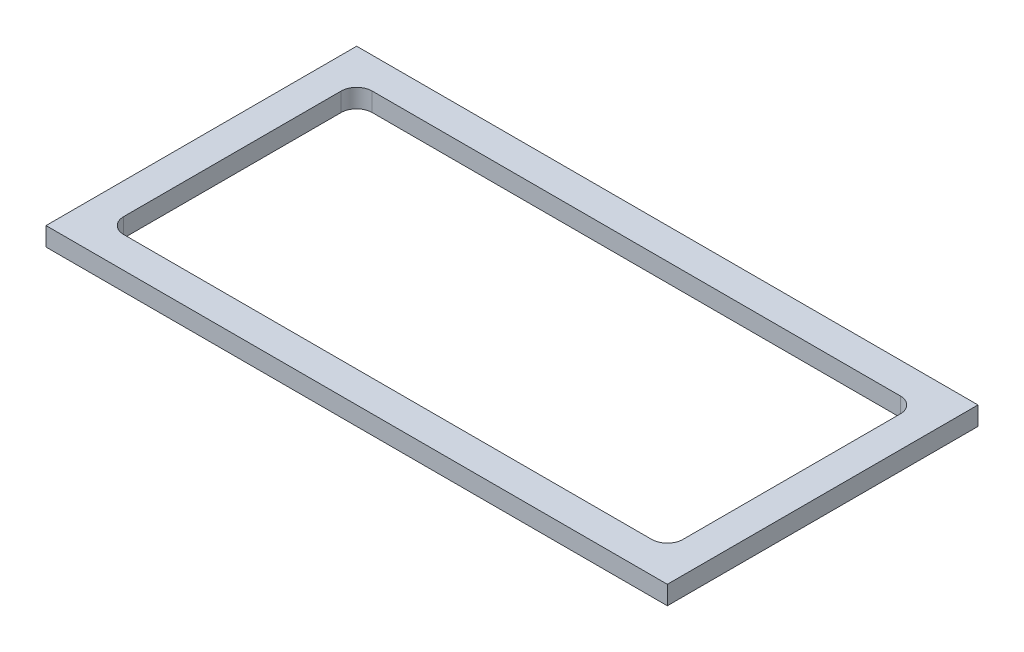
from build123d import *

# Parameters (mm, degrees)
SKETCH1_W           = 200
SKETCH1_H           = 100
BOSS_EXTRUDE1_DEPTH = 6
SKETCH2_W           = 180
SKETCH2_H           = 80
CUT_EXTRUDE1_DEPTH  = 224.687281713
FILLET1_R           = 5


with BuildPart() as part:
    # Sketch1 → Boss-Extrude1 (new body)
    with BuildSketch(Plane(origin=(0, 0, 0), x_dir=(1, 0, 0), z_dir=(0, 1, 0))):
        with Locations((100, 50)):
            Rectangle(SKETCH1_W, SKETCH1_H)
    extrude(amount=BOSS_EXTRUDE1_DEPTH)

    # Sketch2 → Cut-Extrude1 (cut, through all)
    with BuildSketch(Plane(origin=(0, 6, 0), x_dir=(1, 0, 0), z_dir=(0, 1, 0))):
        with Locations((100, 50)):
            Rectangle(SKETCH2_W, SKETCH2_H)
    extrude(amount=-CUT_EXTRUDE1_DEPTH, mode=Mode.SUBTRACT)

    # Fillet1
    fillet1_edges = [part.edges().sort_by_distance(p)[0] for p in [
        (10, 3, -10),
        (10, 3, -90),
        (190, 3, -90),
        (190, 3, -10),
    ]]
    fillet(fillet1_edges, radius=FILLET1_R)


solid = part.part
